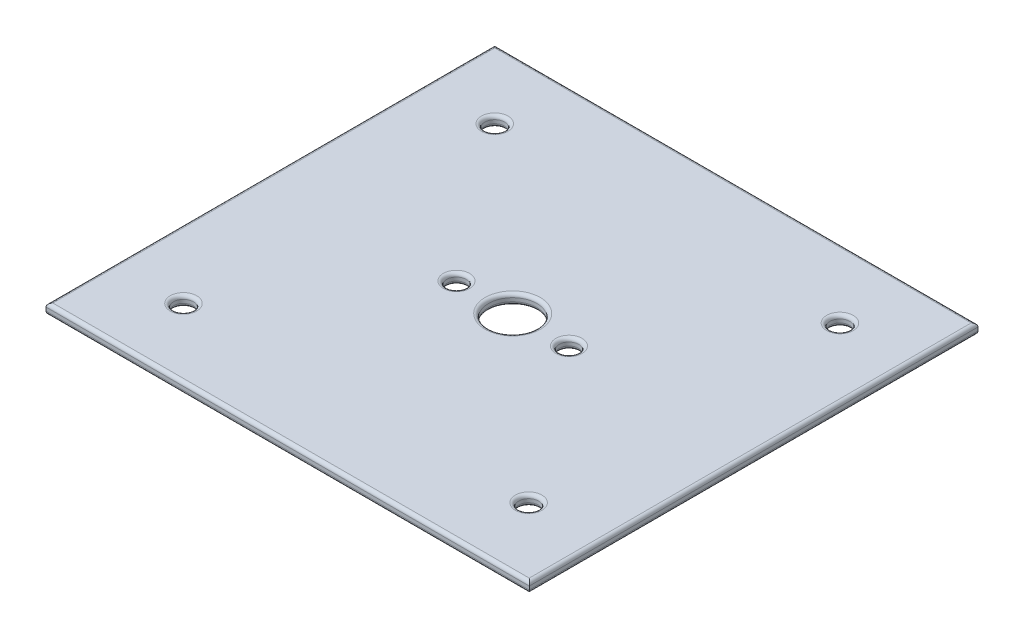
from build123d import *

# Parameters (mm, degrees)
SKETCH1_W           = 70
SKETCH1_H           = 65
BOSS_EXTRUDE1_DEPTH = 1.5
SKETCH3_R           = 1.4224
SKETCH3_R_2         = 3.5
SKETCH3_R_3         = 1.4
CUT_EXTRUDE1_DEPTH  = 10
FILLET1_R           = 0.5


with BuildPart() as part:
    # Sketch1 → Boss-Extrude1 (new body)
    with BuildSketch(Plane(origin=(0, 0, 0), x_dir=(1, 0, 0), z_dir=(0, 1, 0))):
        with Locations((35, 32.5)):
            Rectangle(SKETCH1_W, SKETCH1_H)
    extrude(amount=BOSS_EXTRUDE1_DEPTH)

    # Sketch3 → Cut-Extrude1 (cut)
    with BuildSketch(Plane(origin=(0, 1.5, 0), x_dir=(1, 0, 0), z_dir=(0, 1, 0))):
        with Locations(Location((60, 55, 0), (0, 0, 270))):
            Circle(SKETCH3_R)
        with Locations(Location((60, 9.912121288, 0), (0, 0, 270))):
            Circle(SKETCH3_R)
        with Locations(Location((10, 9.912121288, 0), (0, 0, 270))):
            Circle(SKETCH3_R)
        with Locations(Location((10, 55, 0), (0, 0, 270))):
            Circle(SKETCH3_R)
        with Locations(Location((35.102738261, 32.501850791, 0), (0, 0, 270))):
            Circle(SKETCH3_R_2)
        with Locations(Location((43.251738738, 32.5, 0), (0, 0, 270))):
            Circle(SKETCH3_R_3)
        with Locations(Location((26.953737784, 32.5, 0), (0, 0, 270))):
            Circle(SKETCH3_R_3)
    extrude(amount=-CUT_EXTRUDE1_DEPTH, mode=Mode.SUBTRACT)

    # Fillet1
    fillet1_edges = [part.edges().sort_by_distance(p)[0] for p in [
        (70, 1.5, -32.5),
        (35, 1.5, -65),
        (60, 0, -11.334521288),
        (60, 1.5, -11.334521288),
        (10, 0, -11.334521288),
        (10, 1.5, -11.334521288),
        (10, 0, -56.4224),
        (10, 1.5, -56.4224),
        (35.102738261, 0, -36.001850791),
        (35.102738261, 1.5, -36.001850791),
        (43.251738738, 0, -33.9),
        (43.251738738, 1.5, -33.9),
        (26.953737784, 0, -33.9),
        (26.953737784, 1.5, -33.9),
        (60, 0, -56.4224),
        (60, 1.5, -56.4224),
        (0, 1.5, -32.5),
        (35, 0, -65),
        (70, 0, -32.5),
        (35, 0, 0),
        (0, 0, -32.5),
        (35, 1.5, 0),
    ]]
    fillet(fillet1_edges, radius=FILLET1_R)


solid = part.part
